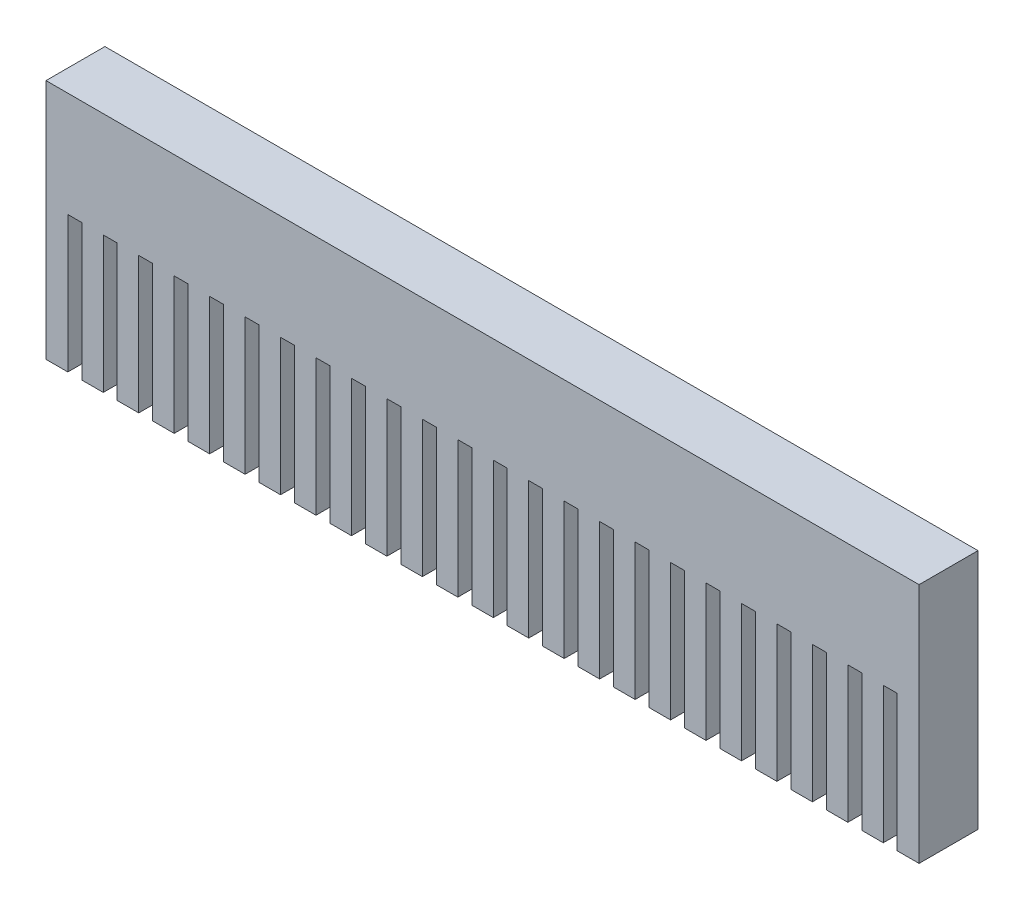
from build123d import *

# Parameters (mm, degrees)
BOSS_EXTRUDE1_DEPTH = 54.864


with BuildPart() as part:
    # Sketch1 → Boss-Extrude1 (new body)
    with BuildSketch(Plane.XY):
        Polygon((33.32, 0), (53.326956522, 0), (53.326956522, 127), (66.326956522, 127), (66.326956522, 0), (86.333913043, 0), (86.333913043, 127), (99.333913043, 127), (99.333913043, 0), (119.340869565, 0), (119.340869565, 127), (132.340869565, 127), (132.340869565, 0), (152.347826087, 0), (152.347826087, 127), (165.347826087, 127), (165.347826087, 0), (185.354782609, 0), (185.354782609, 127), (198.354782609, 127), (198.354782609, 0), (218.36173913, 0), (218.36173913, 127), (231.36173913, 127), (231.36173913, 0), (251.368695652, 0), (251.368695652, 127), (264.368695652, 127), (264.368695652, 0), (284.375652174, 0), (284.375652174, 127), (297.375652174, 127), (297.375652174, 0), (317.382608696, 0), (317.382608696, 127), (330.382608696, 127), (330.382608696, 0), (350.389565217, 0), (350.389565217, 127), (363.389565217, 127), (363.389565217, 0), (383.396521739, 0), (383.396521739, 127), (396.396521739, 127), (396.396521739, 0), (416.403478261, 0), (416.403478261, 127), (429.403478261, 127), (429.403478261, 0), (449.410434783, 0), (449.410434783, 127), (462.410434783, 127), (462.410434783, 0), (482.417391304, 0), (482.417391304, 127), (495.417391304, 127), (495.417391304, 0), (515.424347826, 0), (515.424347826, 127), (528.424347826, 127), (528.424347826, 0), (548.431304348, 0), (548.431304348, 127), (561.431304348, 127), (561.431304348, 0), (581.43826087, 0), (581.43826087, 127), (594.43826087, 127), (594.43826087, 0), (614.445217391, 0), (614.445217391, 127), (627.445217391, 127), (627.445217391, 0), (647.452173913, 0), (647.452173913, 127), (660.452173913, 127), (660.452173913, 0), (680.459130435, 0), (680.459130435, 127), (693.459130435, 127), (693.459130435, 0), (713.466086957, 0), (713.466086957, 127), (726.466086957, 127), (726.466086957, 0), (746.473043478, 0), (746.473043478, 127), (759.473043478, 127), (759.473043478, 0), (779.48, 0), (779.48, 127), (792.48, 127), (792.48, 0), (812.8, 0), (812.8, 224.79), (0, 224.79), (0, 0), (20.32, 0), (20.32, 127), (33.32, 127), align=None)
    extrude(amount=BOSS_EXTRUDE1_DEPTH)


solid = part.part
